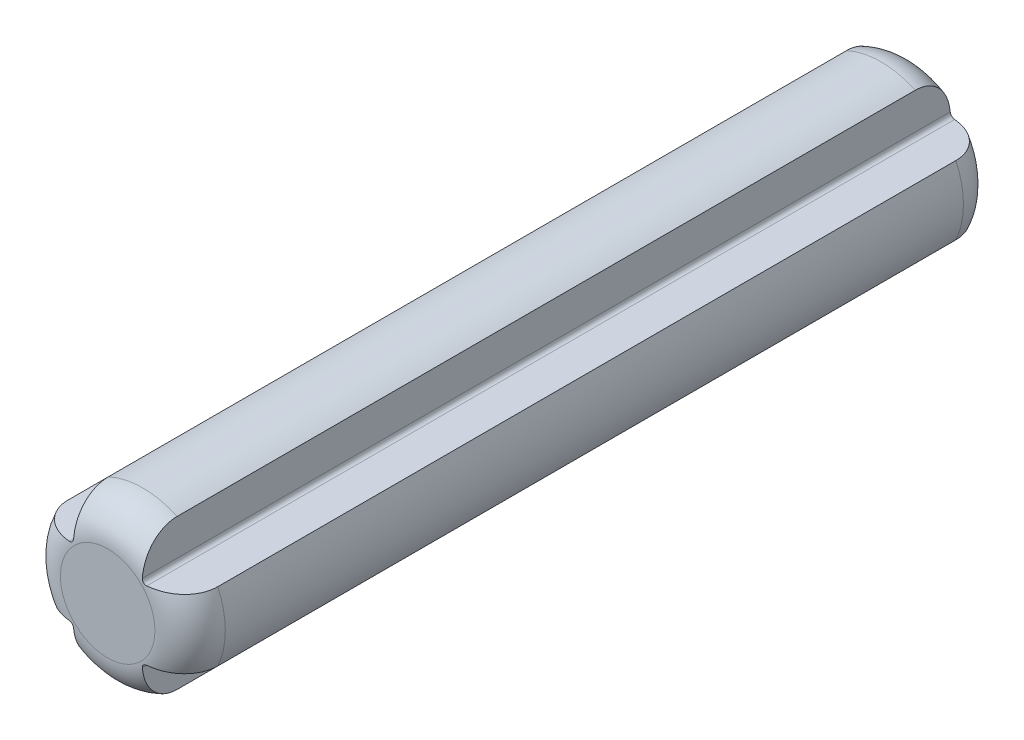
from build123d import *

# Parameters (mm, degrees)
SKETCH1_R           = 2.38125
EXTRUDE1_DEPTH      = 11.6765625
FILLET1_R           = 1.016
EXTRUDE2_DEPTH      = 13.152481882
EXTRUDE2_DEPTH_BACK = 13.152481882


with BuildPart() as part:
    # Sketch1 → Extrude1 (new, symmetric)
    with BuildSketch(Plane.XY):
        Circle(SKETCH1_R)
    extrude(amount=EXTRUDE1_DEPTH, both=True)

    # Fillet1
    fillet1_edges = [part.edges().sort_by_distance(p)[0] for p in [
        (-2.38125, 0, -11.6765625),
        (-2.38125, 0, 11.6765625),
    ]]
    fillet(fillet1_edges, radius=FILLET1_R)

    # Sketch3 → Extrude2 (cut, two sides: drawn at the far end of the back side and taken through both)
    with BuildSketch(Plane.XY.offset(-EXTRUDE2_DEPTH_BACK)):
        with BuildLine():
            Line((-0.9921875, 2.16469756), (-0.9921875, 1.1191875))
            ThreePointArc((-0.9921875, 1.1191875), (-1.029384939, 1.029384939), (-1.1191875, 0.9921875))
            Line((-1.1191875, 0.9921875), (-2.16469756, 0.9921875))
            ThreePointArc((-2.16469756, 0.9921875), (-1.683798023, 1.683798023), (-0.9921875, 2.16469756))
        make_face()
        with BuildLine():
            Line((-2.16469756, -0.9921875), (-1.1191875, -0.9921875))
            ThreePointArc((-1.1191875, -0.9921875), (-1.029384939, -1.029384939), (-0.9921875, -1.1191875))
            Line((-0.9921875, -1.1191875), (-0.9921875, -2.16469756))
            ThreePointArc((-0.9921875, -2.16469756), (-1.683798023, -1.683798023), (-2.16469756, -0.9921875))
        make_face()
        with BuildLine():
            Line((0.9921875, 2.16469756), (0.9921875, 1.1191875))
            ThreePointArc((0.9921875, 1.1191875), (1.029384939, 1.029384939), (1.1191875, 0.9921875))
            Line((1.1191875, 0.9921875), (2.16469756, 0.9921875))
            ThreePointArc((2.16469756, 0.9921875), (1.683798023, 1.683798023), (0.9921875, 2.16469756))
        make_face()
        with BuildLine():
            Line((0.9921875, -1.1191875), (0.9921875, -2.16469756))
            ThreePointArc((0.9921875, -2.16469756), (1.683798023, -1.683798023), (2.16469756, -0.9921875))
            Line((2.16469756, -0.9921875), (1.1191875, -0.9921875))
            ThreePointArc((1.1191875, -0.9921875), (1.029384939, -1.029384939), (0.9921875, -1.1191875))
        make_face()
    extrude(amount=EXTRUDE2_DEPTH + EXTRUDE2_DEPTH_BACK, mode=Mode.SUBTRACT)


solid = part.part
